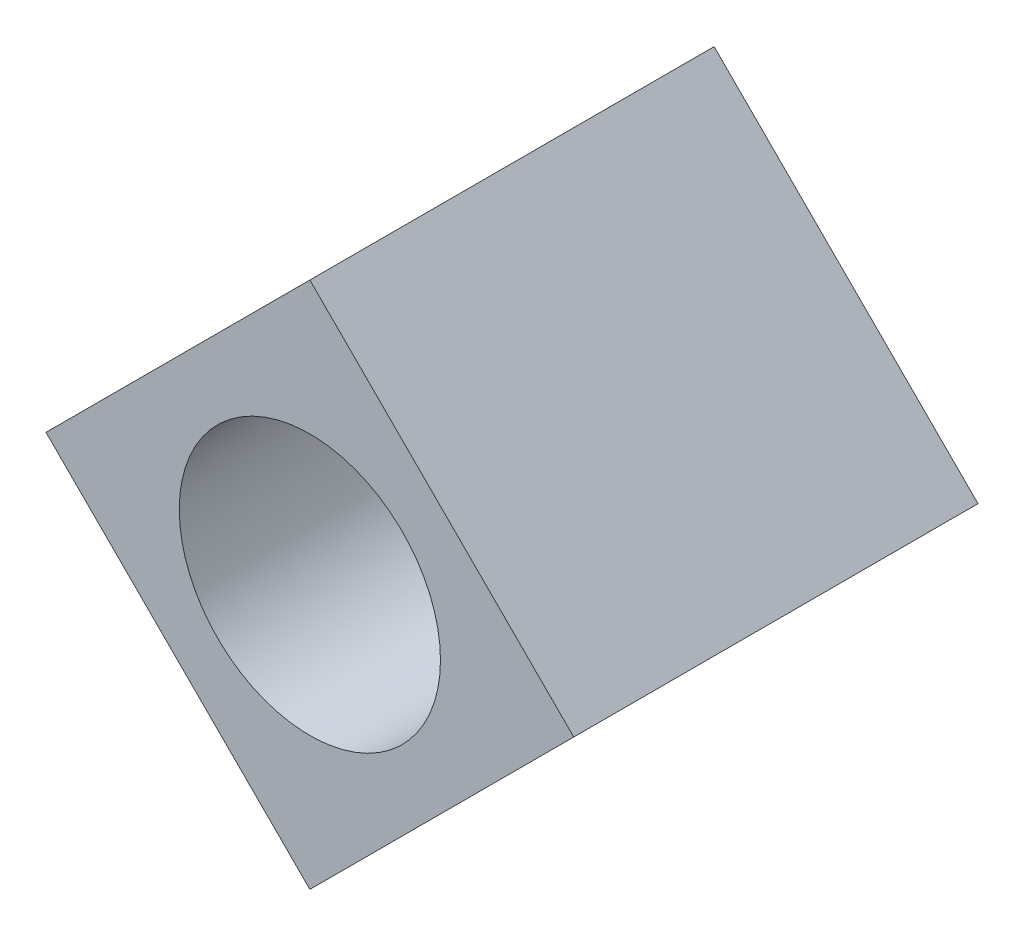
from build123d import *

# Parameters (mm, degrees)
SKETCH_1_R      = 2.1
EXTRUDE_1_DEPTH = 6.5


with BuildPart() as part:
    # ｽｹｯﾁ1 → ﾎﾞｽ - 押し出し1 (new body)
    with BuildSketch(Plane.XY):
        Polygon((4.242640687, 0), (0, 4.242640687), (-4.242640687, 0), (0, -4.242640687), align=None)
        with Locations(Location((0, 0, 0), (0, 0, 180))):
            Circle(SKETCH_1_R, mode=Mode.SUBTRACT)
    extrude(amount=EXTRUDE_1_DEPTH)


solid = part.part
